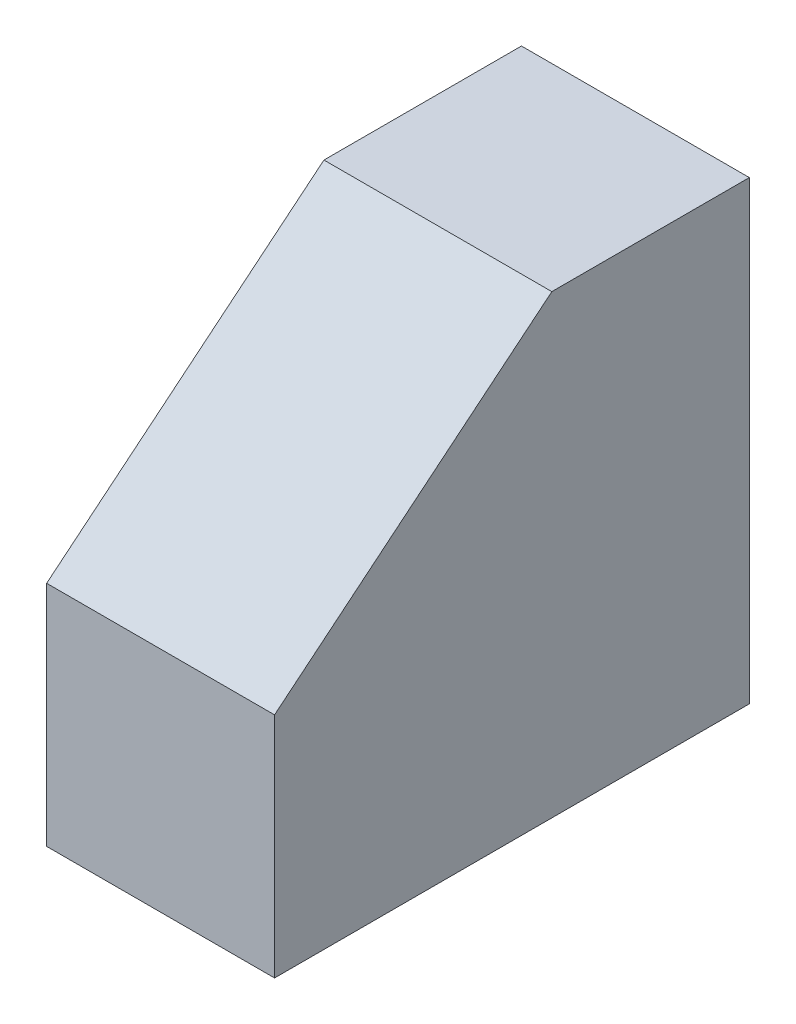
from build123d import *

# Parameters (mm, degrees)
SKETCH_1_W          = 300
SKETCH_1_H          = 625
EXTRUDE_1_DEPTH     = 600
CUT_EXTRUDE_1_DEPTH = 600


with BuildPart() as part:
    # 草图1 → 凸台-拉伸1 (new body)
    with BuildSketch(Plane(origin=(0, 0, 0), x_dir=(1, 0, 0), z_dir=(0, 1, 0))):
        with Locations((150, 312.5)):
            Rectangle(SKETCH_1_W, SKETCH_1_H)
    extrude(amount=EXTRUDE_1_DEPTH)

    # 草图2 → 切除-拉伸1 (cut)
    with BuildSketch(Plane(origin=(300, 0, 0), x_dir=(0, 0, -1), z_dir=(1, 0, 0))):
        Polygon((365, 600), (0, 600), (0, 300), align=None)
    extrude(amount=-CUT_EXTRUDE_1_DEPTH, mode=Mode.SUBTRACT)


solid = part.part
